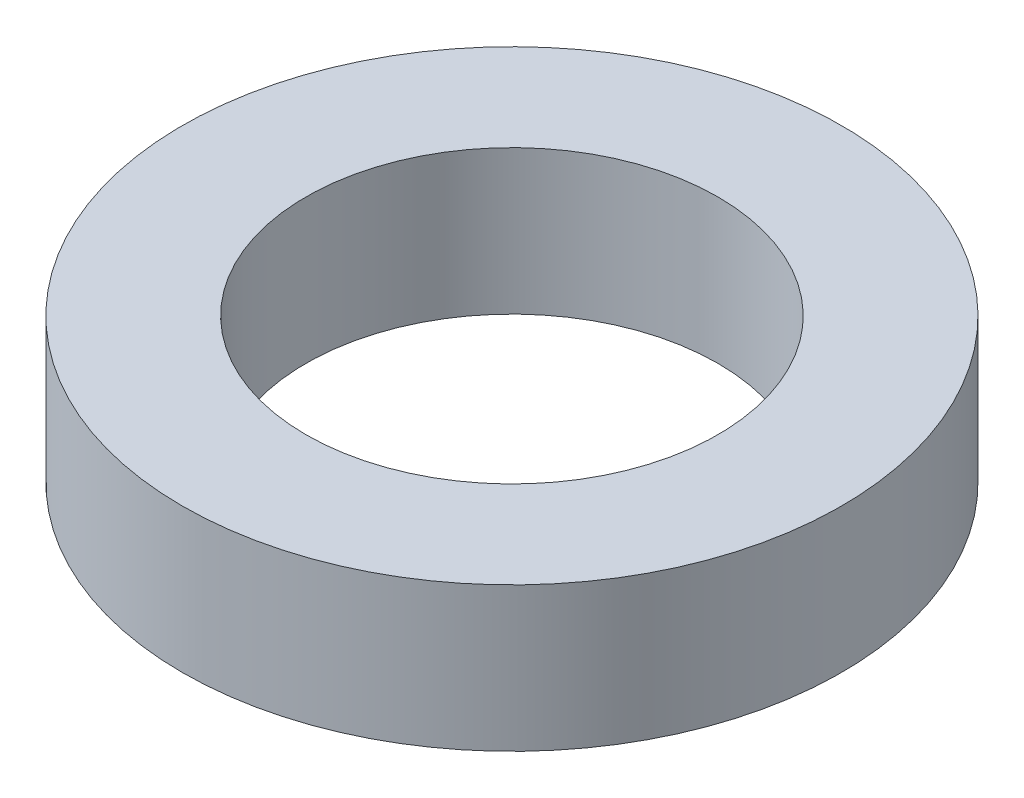
from build123d import *

# Parameters (mm, degrees)
SKETCH_1_R      = 16
SKETCH_1_R_2    = 10
EXTRUDE_1_DEPTH = 7


with BuildPart() as part:
    # 草图1 → 凸台-拉伸1 (new body)
    with BuildSketch(Plane(origin=(0, 0, 0), x_dir=(1, 0, 0), z_dir=(0, 1, 0))):
        with Locations(Location((0, 0, 0), (0, 0, 270))):
            Circle(SKETCH_1_R)
        with Locations(Location((0, 0, 0), (0, 0, 270))):
            Circle(SKETCH_1_R_2, mode=Mode.SUBTRACT)
    extrude(amount=EXTRUDE_1_DEPTH)


solid = part.part
